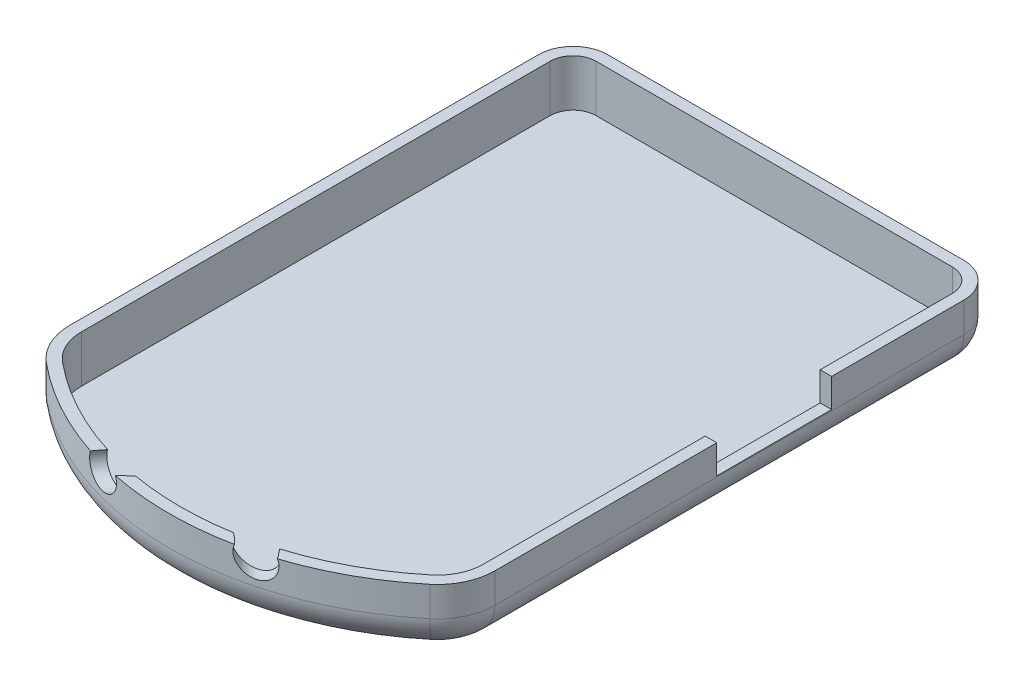
from build123d import *

# Parameters (mm, degrees)
BOSS_EXTRUDE1_DEPTH  = 1.5
BOSS_EXTRUDE2_DEPTH  = 1.6
BOSS_EXTRUDE3_DEPTH  = 2.5
FILLET1_R            = 3
CUT_SWEEP1_PROFILE_R = 1.5


with BuildPart() as part:
    # Sketch1 → Boss-Extrude1 (new body)
    with BuildSketch(Plane(origin=(0, 0, 0), x_dir=(1, 0, 0), z_dir=(0, 1, 0))):
        with BuildLine():
            Line((0, -43.797867681), (0, -43))
            Line((0, -43), (0, -3))
            ThreePointArc((0, -3), (0.878679656, -0.878679656), (3, 0))
            Line((3, 0), (34, 0))
            ThreePointArc((34, 0), (36.121320344, -0.878679656), (37, -3))
            Line((37, -3), (37, -43))
            Line((37, -43), (37, -43.797867681))
            ThreePointArc((37, -43.797867681), (36.524802839, -45.925344888), (35.189536294, -47.648433643))
            ThreePointArc((35.189536294, -47.648433643), (18.5, -53.662950904), (1.810463706, -47.648433643))
            ThreePointArc((1.810463706, -47.648433643), (0.475197161, -45.925344888), (0, -43.797867681))
        make_face()
    extrude(amount=BOSS_EXTRUDE1_DEPTH)

    # Sketch2 → Boss-Extrude2 (add)
    with BuildSketch(Plane(origin=(0, 1.5, 0), x_dir=(1, 0, 0), z_dir=(0, 1, 0))):
        with BuildLine():
            Line((0, -43.797867681), (0, -43))
            Line((0, -43), (0, -3))
            ThreePointArc((0, -3), (0.878679656, -0.878679656), (3, 0))
            Line((3, 0), (34, 0))
            ThreePointArc((34, 0), (36.121320344, -0.878679656), (37, -3))
            Line((37, -3), (37, -43))
            Line((37, -43), (37, -43.797867681))
            ThreePointArc((37, -43.797867681), (36.524802839, -45.925344888), (35.189536294, -47.648433643))
            ThreePointArc((35.189536294, -47.648433643), (18.5, -53.662950904), (1.810463706, -47.648433643))
            ThreePointArc((1.810463706, -47.648433643), (0.475197161, -45.925344888), (0, -43.797867681))
        make_face()
        with BuildLine():
            Line((1, -43.797867681), (1, -43))
            Line((1, -43), (1, -3))
            ThreePointArc((1, -3), (1.585786438, -1.585786438), (3, -1))
            Line((3, -1), (34, -1))
            ThreePointArc((34, -1), (35.414213562, -1.585786438), (36, -3))
            Line((36, -3), (36, -43))
            Line((36, -43), (36, -43.797867681))
            ThreePointArc((36, -43.797867681), (35.619842272, -45.499849447), (34.551629035, -46.878320451))
            ThreePointArc((34.551629035, -46.878320451), (18.5, -52.662950904), (2.448370965, -46.878320451))
            ThreePointArc((2.448370965, -46.878320451), (1.380157728, -45.499849447), (1, -43.797867681))
        make_face(mode=Mode.SUBTRACT)
    extrude(amount=BOSS_EXTRUDE2_DEPTH)

    # Sketch3 → Boss-Extrude3 (add)
    with BuildSketch(Plane(origin=(0, 3.1, 0), x_dir=(1, 0, 0), z_dir=(0, 1, 0))):
        with BuildLine():
            Line((0, -43), (0, -43.797867681))
            ThreePointArc((0, -43.797867681), (0.475197161, -45.925344888), (1.810463706, -47.648433643))
            ThreePointArc((1.810463706, -47.648433643), (18.5, -53.662950904), (35.189536294, -47.648433643))
            ThreePointArc((35.189536294, -47.648433643), (36.524802839, -45.925344888), (37, -43.797867681))
            Line((37, -43.797867681), (37, -43))
            Line((37, -43), (37, -24.5))
            Line((37, -24.5), (36, -24.5))
            Line((36, -24.5), (36, -25.5))
            Line((36, -25.5), (36, -43))
            Line((36, -43), (36, -43.797867681))
            ThreePointArc((36, -43.797867681), (35.619842272, -45.499849447), (34.551629035, -46.878320451))
            ThreePointArc((34.551629035, -46.878320451), (18.5, -52.662950904), (2.448370965, -46.878320451))
            ThreePointArc((2.448370965, -46.878320451), (1.380157728, -45.499849447), (1, -43.797867681))
            Line((1, -43.797867681), (1, -43))
            Line((1, -43), (1, -3))
            ThreePointArc((1, -3), (1.585786438, -1.585786438), (3, -1))
            Line((3, -1), (34, -1))
            ThreePointArc((34, -1), (35.414213562, -1.585786438), (36, -3))
            Line((36, -3), (36, -13.5))
            Line((36, -13.5), (36, -14.5))
            Line((36, -14.5), (37, -14.5))
            Line((37, -14.5), (37, -3))
            ThreePointArc((37, -3), (36.121320344, -0.878679656), (34, 0))
            Line((34, 0), (3, 0))
            ThreePointArc((3, 0), (0.878679656, -0.878679656), (0, -3))
            Line((0, -3), (0, -43))
        make_face()
    extrude(amount=BOSS_EXTRUDE3_DEPTH)

    # Fillet1
    fillet1_edges = [part.edges().sort_by_distance(p)[0] for p in [
        (18.5, 0, 53.662950904),
        (0.475197161, 0, 45.925344888),
        (0, 0, 23.398933841),
        (0.878679656, 0, 0.878679656),
        (18.5, 0, 0),
        (36.121320344, 0, 0.878679656),
        (37, 0, 23.398933841),
        (36.524802839, 0, 45.925344888),
    ]]
    fillet(fillet1_edges, radius=FILLET1_R)

    # Cut-Sweep1: sweep along a path in Sketch4
    with BuildLine(Plane(origin=(0, 5.05, 0), x_dir=(1, 0, 0), z_dir=(0, 1, 0))) as cut_sweep1_path:
        ThreePointArc((26.454418621, -55.003798336), (18.503482621, -49.500000713), (10.548039258, -54.997281172))
    # Cut-Sweep1 profile (on start of the path) → Cut-Sweep1 (sweep, cut)
    with BuildSketch(Plane(origin=(26.454418621, 5.05, 55.003798336), x_dir=(-0.9358139553576565, 0, 0.35249431336953235), z_dir=(-0.35249431336953235, 0, -0.9358139553576565))):
        Circle(CUT_SWEEP1_PROFILE_R)
    sweep(path=cut_sweep1_path.line, mode=Mode.SUBTRACT)


solid = part.part
